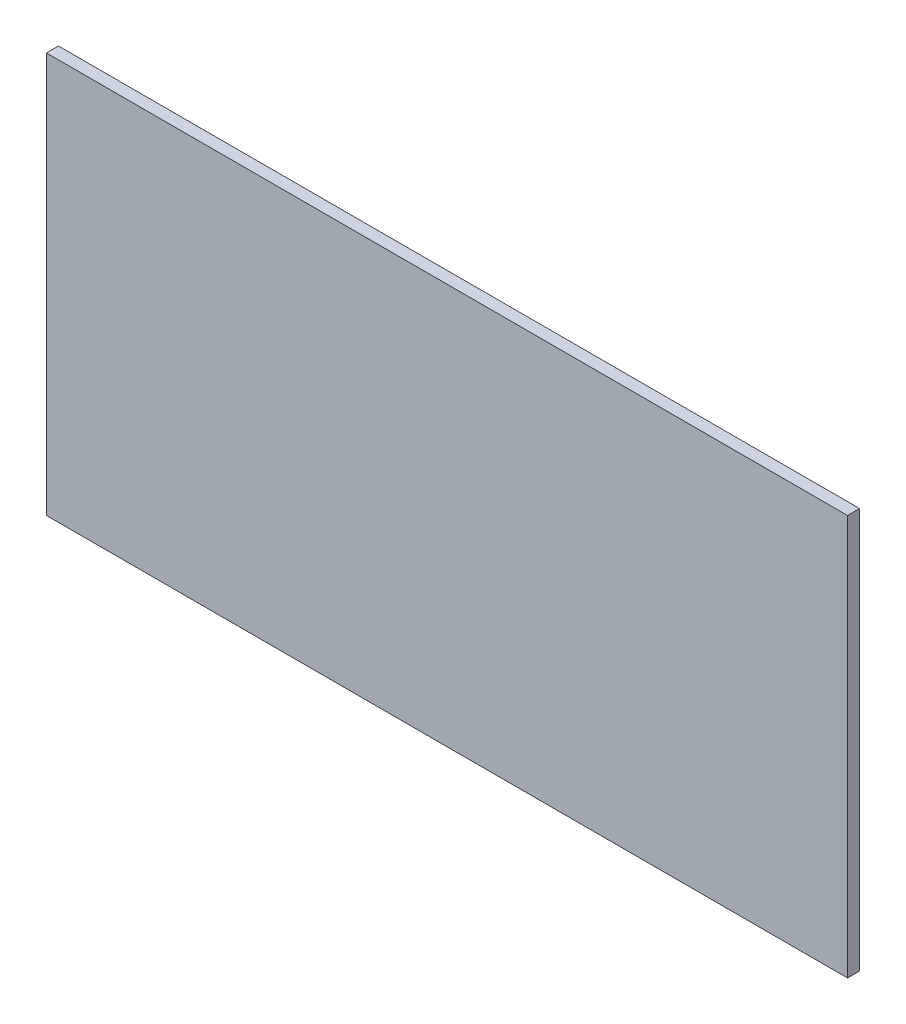
from build123d import *

# Parameters (mm, degrees)
SKETCH1_W           = 200
SKETCH1_H           = 100
BOSS_EXTRUDE1_DEPTH = 3


with BuildPart() as part:
    # Sketch1 → Boss-Extrude1 (new body)
    with BuildSketch(Plane.XY):
        Rectangle(SKETCH1_W, SKETCH1_H)
    extrude(amount=BOSS_EXTRUDE1_DEPTH)


solid = part.part
